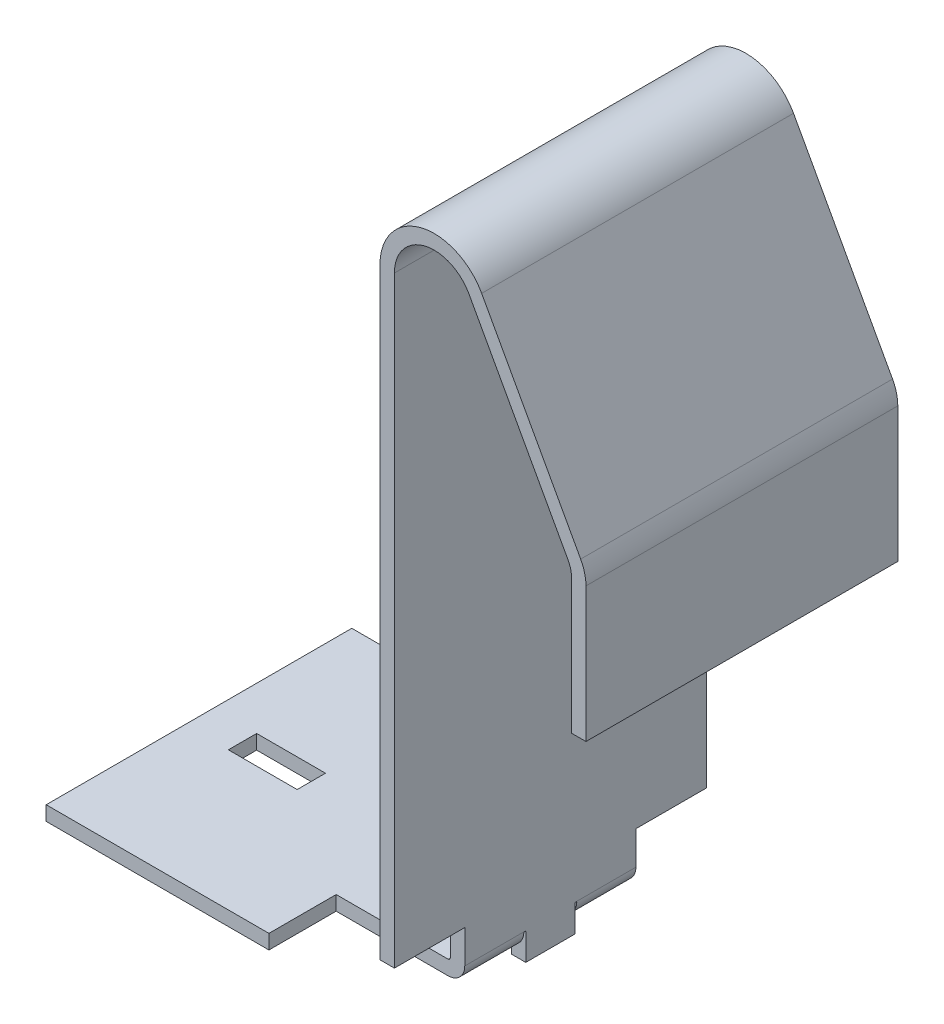
from build123d import *

# Parameters (mm, degrees)
Y_KSEKLIK_EKSTR_ZYON1_DEPTH = 3.24
IZIM2_W                     = 1.429951724
IZIM2_H                     = 0.588312172
KES_EKSTR_ZYON1_DEPTH       = 1.04186858
KES_EKSTR_ZYON2_DEPTH       = 0.5
Y_KSEKLIK_EKSTR_ZYON2_DEPTH = 0.3


with BuildPart() as part:
    # Çizim1 → Yükseklik-Ekstrüzyon1 (new, symmetric)
    with BuildSketch(Plane.XY):
        with BuildLine():
            Line((-0.3, 0.35), (-0.3, 13.55))
            ThreePointArc((-0.3, 13.55), (0.546641464, 14.640795493), (1.813383319, 14.091248725))
            Line((1.813383319, 14.091248725), (3.870705293, 10.338139841))
            ThreePointArc((3.870705293, 10.338139841), (3.952443157, 10.131139603), (3.9802691, 9.910332234))
            Line((3.9802691, 9.910332234), (3.9802691, 7.110332234))
            Line((3.9802691, 7.110332234), (3.6802691, 7.110332234))
            Line((3.6802691, 7.110332234), (3.6802691, 9.910332234))
            ThreePointArc((3.6802691, 9.910332234), (3.661822688, 10.056710153), (3.607636913, 10.19393503))
            Line((3.607636913, 10.19393503), (1.550314939, 13.947043914))
            ThreePointArc((1.550314939, 13.947043914), (0.621070914, 14.350175024), (0, 13.55))
            Line((0, 13.55), (0, 0.35))
            ThreePointArc((0, 0.35), (-0.102512627, 0.102512627), (-0.35, 0))
            Line((-0.35, 0), (-7.3, 0))
            Line((-7.3, 0), (-7.3, 0.3))
            Line((-7.3, 0.3), (-0.35, 0.3))
            ThreePointArc((-0.35, 0.3), (-0.314644661, 0.314644661), (-0.3, 0.35))
        make_face()
    extrude(amount=Y_KSEKLIK_EKSTR_ZYON1_DEPTH, both=True)

    # Çizim2 → Kes-Ekstrüzyon1 (cut)
    with BuildSketch(Plane(origin=(0, 0, 0), x_dir=(1, 0, 0), z_dir=(0, 1, 0))):
        Polygon((0, -4), (0, -1.778), (-2.671699332, -1.778), (-2.671699332, -3.175), (-7.3, -3.175), (-7.3, 3.175), (-2.671699332, 3.175), (-2.671699332, 1.778), (0, 1.778), (0, 4), (-8, 4), (-8, -4), align=None)
        with Locations((-5.68100521, 0)):
            Rectangle(IZIM2_W, IZIM2_H)
    extrude(amount=KES_EKSTR_ZYON1_DEPTH, mode=Mode.SUBTRACT)

    # Çizim4 → Kes-Ekstrüzyon2 (cut)
    with BuildSketch(Plane(origin=(0, 0, 0), x_dir=(0, 0, -1), z_dir=(1, 0, 0))):
        with BuildLine():
            Line((-0.55, -0.15), (0.55, -0.15))
            Line((0.55, -0.15), (0.55, 0.33))
            ThreePointArc((0.55, 0.33), (0.544142136, 0.344142136), (0.53, 0.35))
            Line((0.53, 0.35), (-0.53, 0.35))
            ThreePointArc((-0.53, 0.35), (-0.544142136, 0.344142136), (-0.55, 0.33))
            Line((-0.55, 0.33), (-0.55, -0.15))
        make_face()
    extrude(amount=-KES_EKSTR_ZYON2_DEPTH, mode=Mode.SUBTRACT)

    # Çizim5 → Yükseklik-Ekstrüzyon2 (add)
    with BuildSketch(Plane(origin=(0, 0, 0), x_dir=(0, 0, -1), z_dir=(1, 0, 0))):
        with BuildLine():
            Line((-0.51, -0.22), (0.51, -0.22))
            Line((0.51, -0.22), (0.51, 0.33))
            ThreePointArc((0.51, 0.33), (0.515857864, 0.344142136), (0.53, 0.35))
            Line((0.53, 0.35), (-0.53, 0.35))
            ThreePointArc((-0.53, 0.35), (-0.515857864, 0.344142136), (-0.51, 0.33))
            Line((-0.51, 0.33), (-0.51, -0.22))
        make_face()
    extrude(amount=-Y_KSEKLIK_EKSTR_ZYON2_DEPTH)


solid = part.part
